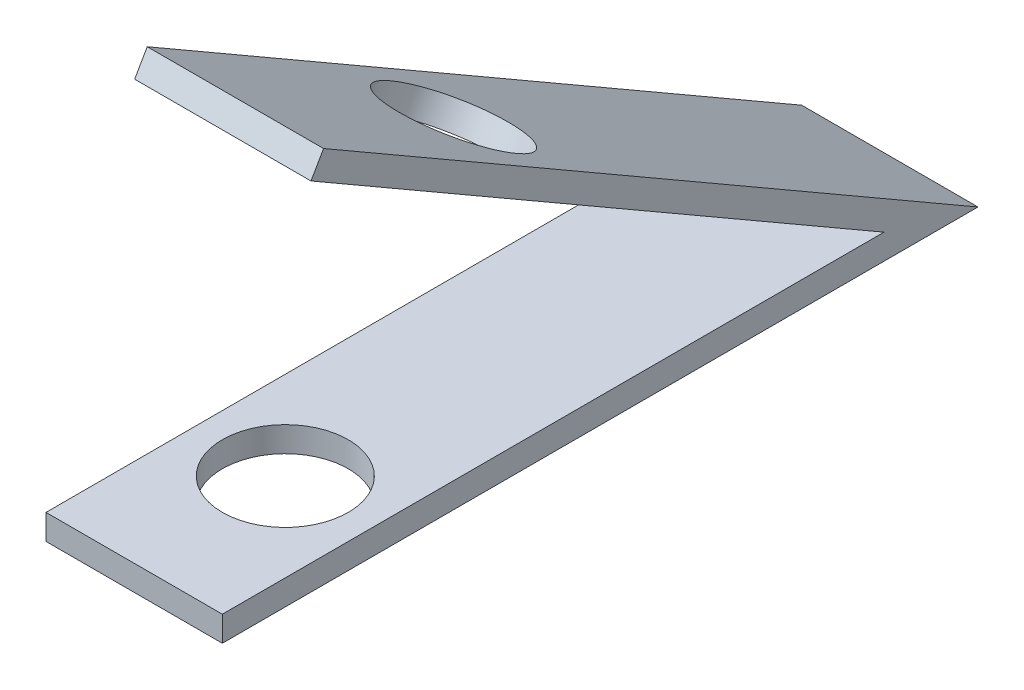
from build123d import *

# Parameters (mm, degrees)
BOSS_EXTRUDE1_DEPTH = 70
SKETCH2_R           = 25
CUT_EXTRUDE1_DEPTH  = 10
SKETCH5_R           = 25
CUT_EXTRUDE3_DEPTH  = 300


with BuildPart() as part:
    # Sketch1 → Boss-Extrude1 (new body)
    with BuildSketch(Plane(origin=(0, 0, 0), x_dir=(0, 0, -1), z_dir=(1, 0, 0))):
        Polygon((-227.48711306, 131.339745962), (0, 0), (-262.679491924, 0), (-262.679491924, -10), (37.320508076, -10), (-222.48711306, 140), align=None)
    extrude(amount=BOSS_EXTRUDE1_DEPTH)

    # Sketch2 → Cut-Extrude1 (cut)
    with BuildSketch(Plane(origin=(0, 8.660254038, -5), x_dir=(1, 0, 0), z_dir=(0, 0.8660254037844418, -0.49999999999999445))):
        with Locations(Location((35, -162.679491924, 0), (0, 0, 270))):
            Circle(SKETCH2_R)
    extrude(amount=-CUT_EXTRUDE1_DEPTH, mode=Mode.SUBTRACT)

    # Sketch5 → Cut-Extrude3 (cut)
    with BuildSketch(Plane(origin=(0, 0, 0), x_dir=(1, 0, 0), z_dir=(0, 1, 0))):
        with Locations(Location((35, -202.679491924, 0), (0, 0, 270))):
            Circle(SKETCH5_R)
    extrude(amount=-CUT_EXTRUDE3_DEPTH, mode=Mode.SUBTRACT)


solid = part.part
